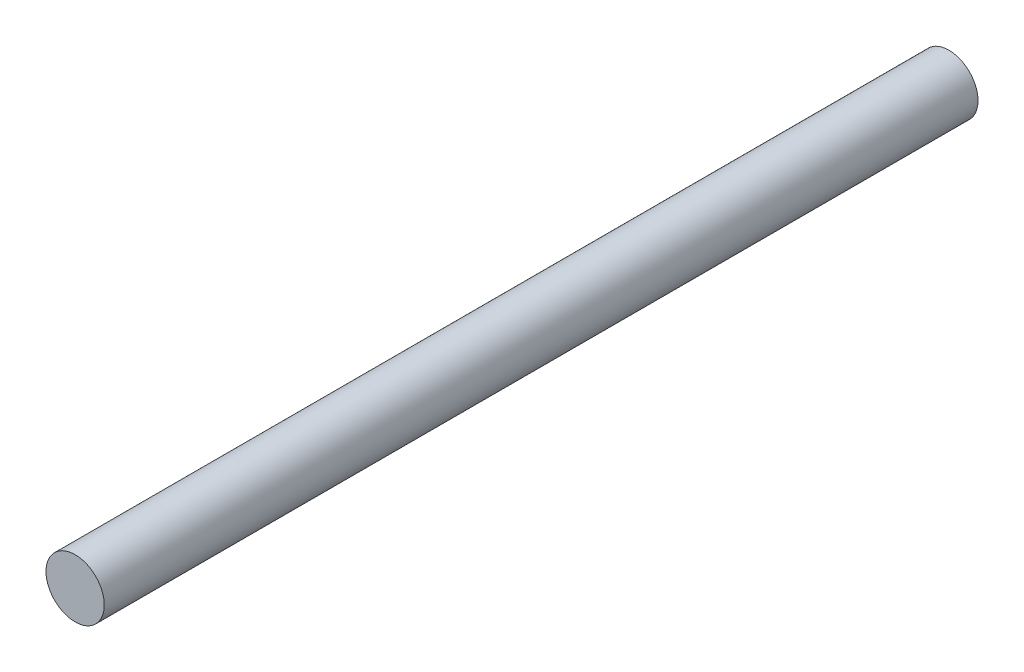
from build123d import *

# Parameters (mm, degrees)
SKETCH_1_R      = 1.5
EXTRUDE_1_DEPTH = 45


with BuildPart() as part:
    # ｽｹｯﾁ1 → ﾎﾞｽ - 押し出し1 (new body)
    with BuildSketch(Plane.XY):
        with Locations(Location((0, 0, 0), (0, 0, 180))):
            Circle(SKETCH_1_R)
    extrude(amount=EXTRUDE_1_DEPTH)


solid = part.part
